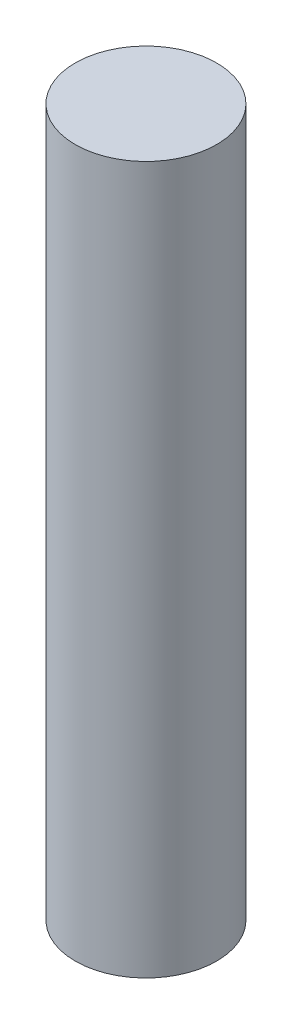
from build123d import *

# Parameters (mm, degrees)
SKETCH1_R           = 1.5
BOSS_EXTRUDE1_DEPTH = 7.5


with BuildPart() as part:
    # Sketch1 → Boss-Extrude1 (new, symmetric)
    with BuildSketch(Plane(origin=(0, 0, 0), x_dir=(1, 0, 0), z_dir=(0, 1, 0))):
        with Locations(Location((0, 0, 0), (0, 0, 270))):
            Circle(SKETCH1_R)
    extrude(amount=BOSS_EXTRUDE1_DEPTH, both=True)


solid = part.part
